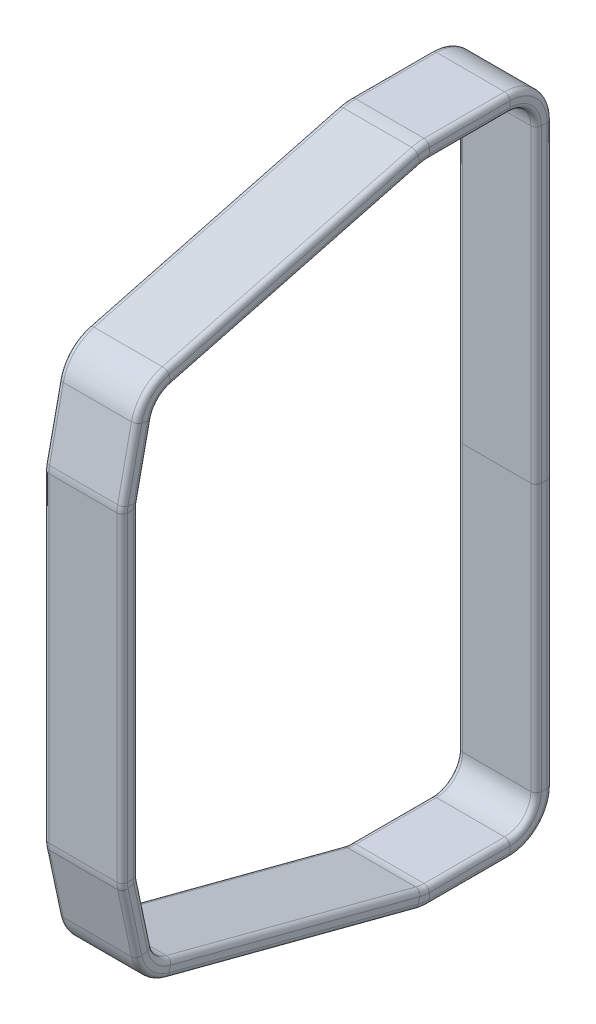
from build123d import *

# Parameters (mm, degrees)
SKETCH3_W = 7.62
SKETCH3_H = 1.5875
FILLET1_R = 0.508


with BuildPart() as part:
    # Sweep1: sweep along a path in Sketch2
    with BuildLine(Plane(origin=(12.652967073, 0, 0), x_dir=(0, 0, -1), z_dir=(1, 0, 0))) as sweep1_path:
        Line((0.8255, -25.883657999), (0.8255, 29.996342001))
        ThreePointArc((0.8255, 29.996342001), (0.081551224, 31.792393225), (-1.7145, 32.536342001))
        Line((-1.7145, 32.536342001), (-9.525, 32.536342001))
        ThreePointArc((-9.525, 32.536342001), (-9.930637017, 32.510323362), (-10.329625768, 32.432693881))
        Line((-10.329625768, 32.432693881), (-34.489200615, 26.103423505))
        ThreePointArc((-34.489200615, 26.103423505), (-35.683232492, 25.399721391), (-36.330095218, 24.173965541))
        Line((-36.330095218, 24.173965541), (-37.665372012, 17.886106714))
        ThreePointArc((-37.665372012, 17.886106714), (-37.691319269, 17.72213092), (-37.7, 17.556342001))
        Line((-37.7, 17.556342001), (-37.7, -13.443657999))
        ThreePointArc((-37.7, -13.443657999), (-37.691319269, -13.609446919), (-37.665372012, -13.773422712))
        Line((-37.665372012, -13.773422712), (-36.330095218, -20.061281539))
        ThreePointArc((-36.330095218, -20.061281539), (-35.683232492, -21.287037389), (-34.489200615, -21.990739503))
        Line((-34.489200615, -21.990739503), (-10.329625768, -28.320009879))
        ThreePointArc((-10.329625768, -28.320009879), (-9.930637017, -28.39763936), (-9.525, -28.423657999))
        Line((-9.525, -28.423657999), (-1.7145, -28.423657999))
        ThreePointArc((-1.7145, -28.423657999), (0.081551224, -27.679709223), (0.8255, -25.883657999))
    # Sketch3 → Sweep1 (sweep)
    with BuildSketch(Plane(origin=(0, 0, 0), x_dir=(1, 0, 0), z_dir=(0, 1, 0))):
        with Locations((12.652967073, 1.61925)):
            Rectangle(SKETCH3_W, SKETCH3_H)
    sweep(path=sweep1_path.line)

    # Fillet1
    fillet1_edges = [part.edges().sort_by_distance(p)[0] for p in [
        (16.462967073, -26.691050632, 22.811726076),
        (8.842967073, -26.691050632, 22.811726076),
        (8.842967073, -25.155374691, 22.409413191),
        (16.462967073, -21.287037389, 35.683232492),
        (16.462967073, -22.382899508, 36.8318153),
        (8.842967073, -22.382899508, 36.8318153),
        (8.842967073, -21.287037389, 35.683232492),
        (16.462967073, -16.917352126, 36.997733615),
        (16.462967073, -17.247116838, 38.550605627),
        (8.842967073, -17.247116838, 38.550605627),
        (8.842967073, -16.917352126, 36.997733615),
        (16.462967073, -13.609446919, 37.691319269),
        (16.462967073, -13.775235838, 39.270138538),
        (8.842967073, -13.775235838, 39.270138538),
        (16.462967073, 2.056342001, -0.8255),
        (8.842967073, -13.609446919, 37.691319269),
        (16.462967073, 2.056342001, 37.7),
        (16.462967073, 2.056342001, 39.2875),
        (8.842967073, 2.056342001, 39.2875),
        (8.842967073, 2.056342001, 37.7),
        (16.462967073, 2.056342001, -2.413),
        (16.462967073, 17.72213092, 37.691319269),
        (16.462967073, 17.88791984, 39.270138538),
        (8.842967073, 17.88791984, 39.270138538),
        (8.842967073, 17.72213092, 37.691319269),
        (16.462967073, 21.030036127, 36.997733615),
        (16.462967073, 21.35980084, 38.550605627),
        (8.842967073, 21.35980084, 38.550605627),
        (8.842967073, 2.056342001, -2.413),
        (8.842967073, 21.030036127, 36.997733615),
        (16.462967073, 25.399721391, 35.683232492),
        (16.462967073, 26.49558351, 36.8318153),
        (8.842967073, 26.49558351, 36.8318153),
        (8.842967073, 25.399721391, 35.683232492),
        (16.462967073, 29.268058693, 22.409413191),
        (16.462967073, 30.803734633, 22.811726076),
        (8.842967073, 30.803734633, 22.811726076),
        (8.842967073, 29.268058693, 22.409413191),
        (16.462967073, 32.510323362, 9.930637017),
        (8.842967073, 2.056342001, -0.8255),
        (16.462967073, 34.084814042, 10.133455526),
        (8.842967073, 34.084814042, 10.133455526),
        (8.842967073, 32.510323362, 9.930637017),
        (16.462967073, 32.536342001, 5.61975),
        (16.462967073, 34.123842001, 5.61975),
        (8.842967073, 34.123842001, 5.61975),
        (8.842967073, 32.536342001, 5.61975),
        (16.462967073, 31.792393225, -0.081551224),
        (16.462967073, 32.91492524, -1.204083239),
        (8.842967073, 32.91492524, -1.204083239),
        (8.842967073, 31.792393225, -0.081551224),
        (16.462967073, 2.056342001, -0.8255),
        (16.462967073, 2.056342001, -2.413),
        (8.842967073, 2.056342001, -2.413),
        (8.842967073, 2.056342001, -0.8255),
        (16.462967073, -27.679709223, -0.081551224),
        (16.462967073, -28.802241238, -1.204083239),
        (8.842967073, -28.802241238, -1.204083239),
        (8.842967073, -27.679709223, -0.081551224),
        (16.462967073, -28.423657999, 5.61975),
        (16.462967073, -30.011157999, 5.61975),
        (8.842967073, -30.011157999, 5.61975),
        (8.842967073, -28.423657999, 5.61975),
        (16.462967073, -28.39763936, 9.930637017),
        (16.462967073, -29.97213004, 10.133455526),
        (8.842967073, -29.97213004, 10.133455526),
        (8.842967073, -28.39763936, 9.930637017),
        (16.462967073, -25.155374691, 22.409413191),
    ]]
    fillet(fillet1_edges, radius=FILLET1_R)


solid = part.part
